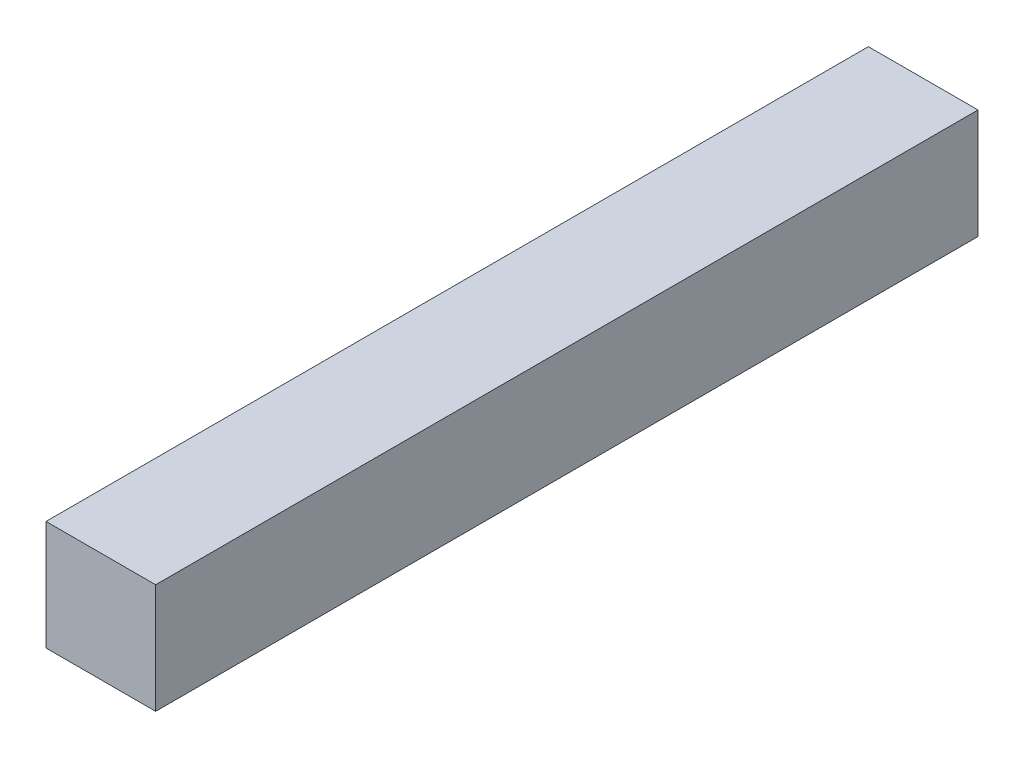
from build123d import *

# Parameters (mm, degrees)
SKETCH_1_W      = 4
SKETCH_1_H      = 4
EXTRUDE_1_DEPTH = 30


with BuildPart() as part:
    # 草圖1 → 填料-伸長1 (new body)
    with BuildSketch(Plane.XY):
        Rectangle(SKETCH_1_W, SKETCH_1_H)
    extrude(amount=EXTRUDE_1_DEPTH)


solid = part.part
